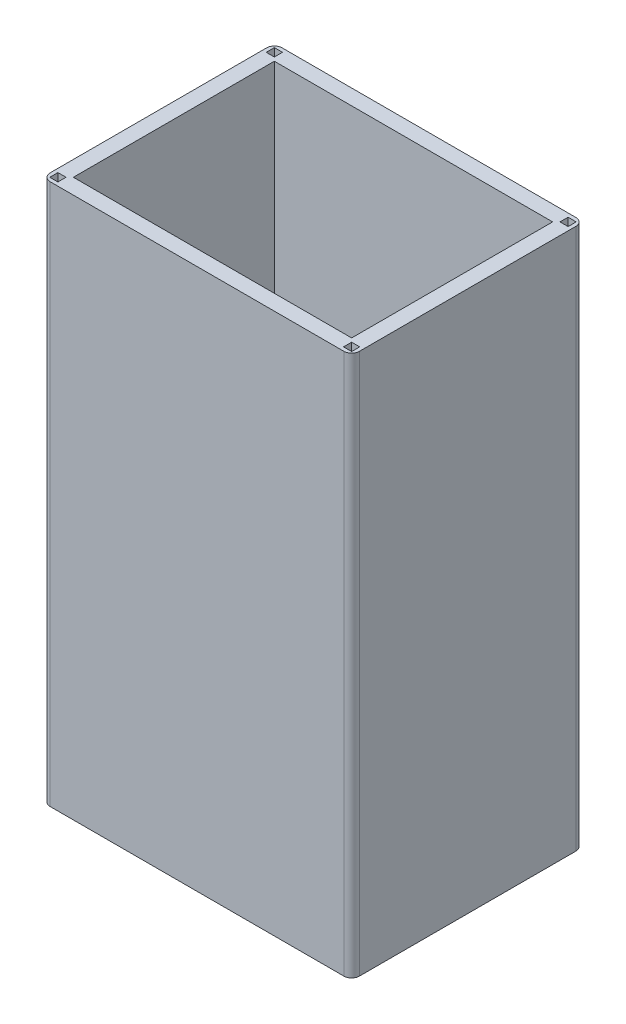
from build123d import *

# Parameters (mm, degrees)
SKETCH1_W               = 101.6
SKETCH1_H               = 76.2
BOSS_EXTRUDE1_DEPTH     = 177.8
SHELL1_T                = -5.08
SKETCH2_W               = 2.667
SKETCH2_H               = 2.667
CUT_EXTRUDE1_DEPTH      = 15.24
CUT_EXTRUDE1_DRAFT      = -1
MIRROR1_COPY_1_SKETCH_W = 2.667
MIRROR1_COPY_1_SKETCH_H = 2.667
MIRROR1_COPY_1_DEPTH    = 15.24
MIRROR1_COPY_1_DRAFT    = -1
MIRROR2_COPY_1_SKETCH_W = 2.667
MIRROR2_COPY_1_SKETCH_H = 2.667
MIRROR2_COPY_1_DEPTH    = 15.24
MIRROR2_COPY_1_DRAFT    = -1
MIRROR2_COPY_2_SKETCH_W = 2.667
MIRROR2_COPY_2_SKETCH_H = 2.667
MIRROR2_COPY_2_DEPTH    = 15.24
MIRROR2_COPY_2_DRAFT    = -1
MIRROR3_COPY_1_SKETCH_W = 2.667
MIRROR3_COPY_1_SKETCH_H = 2.667
MIRROR3_COPY_1_DEPTH    = 15.24
MIRROR3_COPY_1_DRAFT    = -1
MIRROR3_COPY_2_SKETCH_W = 2.667
MIRROR3_COPY_2_SKETCH_H = 2.667
MIRROR3_COPY_2_DEPTH    = 15.24
MIRROR3_COPY_2_DRAFT    = -1
MIRROR3_COPY_3_SKETCH_W = 2.667
MIRROR3_COPY_3_SKETCH_H = 2.667
MIRROR3_COPY_3_DEPTH    = 15.24
MIRROR3_COPY_3_DRAFT    = -1
MIRROR3_COPY_4_SKETCH_W = 2.667
MIRROR3_COPY_4_SKETCH_H = 2.667
MIRROR3_COPY_4_DEPTH    = 15.24
MIRROR3_COPY_4_DRAFT    = -1
SKETCH3_W               = 63.5
SKETCH3_H               = 91.44
SKETCH3_W_2             = 58.42
SKETCH3_H_2             = 86.36
EXTRUDE_THIN1_DEPTH     = 12.7
SKETCH4_W               = 25.4
SKETCH4_H               = 91.44
CUT_EXTRUDE_THIN1_DEPTH = 12.7
FILLET1_R               = 2.54


with BuildPart() as part:
    # Sketch1 → Boss-Extrude1 (new body)
    with BuildSketch(Plane(origin=(0, 0, 0), x_dir=(1, 0, 0), z_dir=(0, 1, 0))):
        Rectangle(SKETCH1_W, SKETCH1_H)
    extrude(amount=BOSS_EXTRUDE1_DEPTH)

    # Shell1
    shell1_openings = [part.faces().sort_by_distance(p)[0] for p in [
        (0, 177.8, 0),
        (0, 0, 0),
    ]]
    offset(amount=SHELL1_T, openings=shell1_openings, kind=Kind.INTERSECTION)


with BuildPart() as cut_extrude1_tool:
    # Sketch2 → Cut-Extrude1 (with draft: the straight prism first)
    with BuildSketch(Plane(origin=(0, 177.8, 0), x_dir=(1, 0, 0), z_dir=(0, 1, 0))):
        with Locations((-48.26, 35.56)):
            Rectangle(SKETCH2_W, SKETCH2_H)
    extrude(amount=-CUT_EXTRUDE1_DEPTH)
    # Cut-Extrude1: the draft: its side faces are tilted about the plane it starts from
    cut_extrude1_sides = [cut_extrude1_tool.faces().sort_by_distance(p)[0] for p in [
        (-49.5935, 170.18, -35.56),
        (-48.26, 170.18, -34.2265),
        (-46.9265, 170.18, -35.56),
        (-48.26, 170.18, -36.8935),
    ]]
    draft(cut_extrude1_sides, Plane(origin=(0, 177.8, 0), x_dir=(1, 0, 0), z_dir=(0, 1, 0)), CUT_EXTRUDE1_DRAFT)


with BuildPart() as part_1:
    add(part.part)

    # Cut-Extrude1: cut by cut_extrude1_tool
    add(cut_extrude1_tool.part, mode=Mode.SUBTRACT)


with BuildPart() as mirror1_copy_1_tool:
    # Mirror1 copy 1 sketch → Mirror1 copy 1 (with draft: the straight prism first)
    with BuildSketch(Plane(origin=(0, 177.8, 0), x_dir=(1, 0, 0), z_dir=(0, 1, 0))):
        with Locations((-48.26, -35.56)):
            Rectangle(MIRROR1_COPY_1_SKETCH_W, MIRROR1_COPY_1_SKETCH_H)
    extrude(amount=-MIRROR1_COPY_1_DEPTH)
    # Mirror1 copy 1: the draft: its side faces are tilted about the plane it starts from
    mirror1_copy_1_sides = [mirror1_copy_1_tool.faces().sort_by_distance(p)[0] for p in [
        (-49.5935, 170.18, 35.56),
        (-48.26, 170.18, 34.2265),
        (-46.9265, 170.18, 35.56),
        (-48.26, 170.18, 36.8935),
    ]]
    draft(mirror1_copy_1_sides, Plane(origin=(0, 177.8, 0), x_dir=(1, 0, 0), z_dir=(0, 1, 0)), MIRROR1_COPY_1_DRAFT)


with BuildPart() as part_2:
    add(part_1.part)

    # Mirror1 copy 1: cut by mirror1_copy_1_tool
    add(mirror1_copy_1_tool.part, mode=Mode.SUBTRACT)


with BuildPart() as mirror2_copy_1_tool:
    # Mirror2 copy 1 sketch → Mirror2 copy 1 (with draft: the straight prism first)
    with BuildSketch(Plane(origin=(0, 177.8, 0), x_dir=(-1, 0, 0), z_dir=(0, 1, 0))):
        with Locations((-48.26, -35.56)):
            Rectangle(MIRROR2_COPY_1_SKETCH_W, MIRROR2_COPY_1_SKETCH_H)
    extrude(amount=-MIRROR2_COPY_1_DEPTH)
    # Mirror2 copy 1: the draft: its side faces are tilted about the plane it starts from
    mirror2_copy_1_sides = [mirror2_copy_1_tool.faces().sort_by_distance(p)[0] for p in [
        (49.5935, 170.18, -35.56),
        (48.26, 170.18, -34.2265),
        (46.9265, 170.18, -35.56),
        (48.26, 170.18, -36.8935),
    ]]
    draft(mirror2_copy_1_sides, Plane(origin=(0, 177.8, 0), x_dir=(-1, 0, 0), z_dir=(0, 1, 0)), MIRROR2_COPY_1_DRAFT)


with BuildPart() as part_3:
    add(part_2.part)

    # Mirror2 copy 1: cut by mirror2_copy_1_tool
    add(mirror2_copy_1_tool.part, mode=Mode.SUBTRACT)


with BuildPart() as mirror2_copy_2_tool:
    # Mirror2 copy 2 sketch → Mirror2 copy 2 (with draft: the straight prism first)
    with BuildSketch(Plane(origin=(0, 177.8, 0), x_dir=(-1, 0, 0), z_dir=(0, 1, 0))):
        with Locations((-48.26, 35.56)):
            Rectangle(MIRROR2_COPY_2_SKETCH_W, MIRROR2_COPY_2_SKETCH_H)
    extrude(amount=-MIRROR2_COPY_2_DEPTH)
    # Mirror2 copy 2: the draft: its side faces are tilted about the plane it starts from
    mirror2_copy_2_sides = [mirror2_copy_2_tool.faces().sort_by_distance(p)[0] for p in [
        (49.5935, 170.18, 35.56),
        (48.26, 170.18, 34.2265),
        (46.9265, 170.18, 35.56),
        (48.26, 170.18, 36.8935),
    ]]
    draft(mirror2_copy_2_sides, Plane(origin=(0, 177.8, 0), x_dir=(-1, 0, 0), z_dir=(0, 1, 0)), MIRROR2_COPY_2_DRAFT)


with BuildPart() as part_4:
    add(part_3.part)

    # Mirror2 copy 2: cut by mirror2_copy_2_tool
    add(mirror2_copy_2_tool.part, mode=Mode.SUBTRACT)


with BuildPart() as mirror3_copy_1_tool:
    # Mirror3 copy 1 sketch → Mirror3 copy 1 (with draft: the straight prism first)
    with BuildSketch(Plane.XZ):
        with Locations((-48.26, -35.56)):
            Rectangle(MIRROR3_COPY_1_SKETCH_W, MIRROR3_COPY_1_SKETCH_H)
    extrude(amount=-MIRROR3_COPY_1_DEPTH)
    # Mirror3 copy 1: the draft: its side faces are tilted about the plane it starts from
    mirror3_copy_1_sides = [mirror3_copy_1_tool.faces().sort_by_distance(p)[0] for p in [
        (-49.5935, 7.62, -35.56),
        (-48.26, 7.62, -34.2265),
        (-46.9265, 7.62, -35.56),
        (-48.26, 7.62, -36.8935),
    ]]
    draft(mirror3_copy_1_sides, Plane.XZ, MIRROR3_COPY_1_DRAFT)


with BuildPart() as part_5:
    add(part_4.part)

    # Mirror3 copy 1: cut by mirror3_copy_1_tool
    add(mirror3_copy_1_tool.part, mode=Mode.SUBTRACT)


with BuildPart() as mirror3_copy_2_tool:
    # Mirror3 copy 2 sketch → Mirror3 copy 2 (with draft: the straight prism first)
    with BuildSketch(Plane.XZ):
        with Locations((-48.26, 35.56)):
            Rectangle(MIRROR3_COPY_2_SKETCH_W, MIRROR3_COPY_2_SKETCH_H)
    extrude(amount=-MIRROR3_COPY_2_DEPTH)
    # Mirror3 copy 2: the draft: its side faces are tilted about the plane it starts from
    mirror3_copy_2_sides = [mirror3_copy_2_tool.faces().sort_by_distance(p)[0] for p in [
        (-49.5935, 7.62, 35.56),
        (-48.26, 7.62, 34.2265),
        (-46.9265, 7.62, 35.56),
        (-48.26, 7.62, 36.8935),
    ]]
    draft(mirror3_copy_2_sides, Plane.XZ, MIRROR3_COPY_2_DRAFT)


with BuildPart() as part_6:
    add(part_5.part)

    # Mirror3 copy 2: cut by mirror3_copy_2_tool
    add(mirror3_copy_2_tool.part, mode=Mode.SUBTRACT)


with BuildPart() as mirror3_copy_3_tool:
    # Mirror3 copy 3 sketch → Mirror3 copy 3 (with draft: the straight prism first)
    with BuildSketch(Plane(origin=(0, 0, 0), x_dir=(-1, 0, 0), z_dir=(0, -1, 0))):
        with Locations((-48.26, 35.56)):
            Rectangle(MIRROR3_COPY_3_SKETCH_W, MIRROR3_COPY_3_SKETCH_H)
    extrude(amount=-MIRROR3_COPY_3_DEPTH)
    # Mirror3 copy 3: the draft: its side faces are tilted about the plane it starts from
    mirror3_copy_3_sides = [mirror3_copy_3_tool.faces().sort_by_distance(p)[0] for p in [
        (49.5935, 7.62, -35.56),
        (48.26, 7.62, -34.2265),
        (46.9265, 7.62, -35.56),
        (48.26, 7.62, -36.8935),
    ]]
    draft(mirror3_copy_3_sides, Plane(origin=(0, 0, 0), x_dir=(-1, 0, 0), z_dir=(0, -1, 0)), MIRROR3_COPY_3_DRAFT)


with BuildPart() as part_7:
    add(part_6.part)

    # Mirror3 copy 3: cut by mirror3_copy_3_tool
    add(mirror3_copy_3_tool.part, mode=Mode.SUBTRACT)


with BuildPart() as mirror3_copy_4_tool:
    # Mirror3 copy 4 sketch → Mirror3 copy 4 (with draft: the straight prism first)
    with BuildSketch(Plane(origin=(0, 0, 0), x_dir=(-1, 0, 0), z_dir=(0, -1, 0))):
        with Locations((-48.26, -35.56)):
            Rectangle(MIRROR3_COPY_4_SKETCH_W, MIRROR3_COPY_4_SKETCH_H)
    extrude(amount=-MIRROR3_COPY_4_DEPTH)
    # Mirror3 copy 4: the draft: its side faces are tilted about the plane it starts from
    mirror3_copy_4_sides = [mirror3_copy_4_tool.faces().sort_by_distance(p)[0] for p in [
        (49.5935, 7.62, 35.56),
        (48.26, 7.62, 34.2265),
        (46.9265, 7.62, 35.56),
        (48.26, 7.62, 36.8935),
    ]]
    draft(mirror3_copy_4_sides, Plane(origin=(0, 0, 0), x_dir=(-1, 0, 0), z_dir=(0, -1, 0)), MIRROR3_COPY_4_DRAFT)


with BuildPart() as part_8:
    add(part_7.part)

    # Mirror3 copy 4: cut by mirror3_copy_4_tool
    add(mirror3_copy_4_tool.part, mode=Mode.SUBTRACT)

    # Sketch3 → Extrude-Thin1 (add)
    with BuildSketch(Plane(origin=(0, 0, 33.02), x_dir=(-1, 0, 0), z_dir=(0, 0, -1))):
        with Locations((0, 101.6)):
            Rectangle(SKETCH3_W, SKETCH3_H)
        with Locations((0, 101.6)):
            Rectangle(SKETCH3_W_2, SKETCH3_H_2, mode=Mode.SUBTRACT)
    extrude(amount=EXTRUDE_THIN1_DEPTH)

    # Sketch4 → Cut-Extrude-Thin1 (cut)
    with BuildSketch(Plane(origin=(0, 0, 20.32), x_dir=(-1, 0, 0), z_dir=(0, 0, -1))):
        with Locations((0, 101.6)):
            Rectangle(SKETCH4_W, SKETCH4_H)
    extrude(amount=-CUT_EXTRUDE_THIN1_DEPTH, mode=Mode.SUBTRACT)

    # Fillet1
    fillet1_edges = [part_8.edges().sort_by_distance(p)[0] for p in [
        (50.8, 88.9, 38.1),
        (-50.8, 88.9, 38.1),
        (-50.8, 88.9, -38.1),
        (50.8, 88.9, -38.1),
    ]]
    fillet(fillet1_edges, radius=FILLET1_R)


solid = part_8.part
